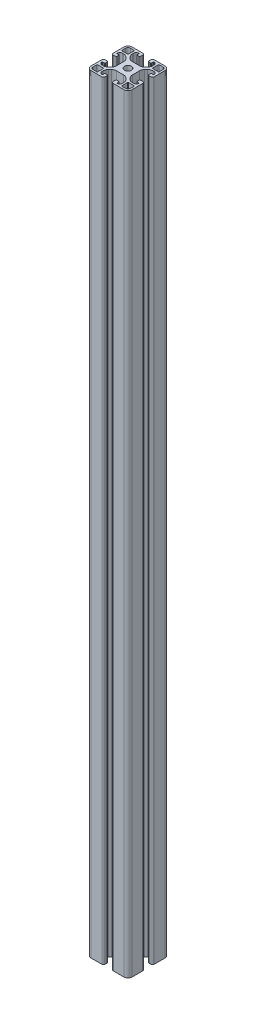
from build123d import *

# Parameters (mm, degrees)
SZKIC2_R                    = 3.4
DODANIE_WYCI_GNI_CIE2_DEPTH = 375


with BuildPart() as part:
    # Szkic2 → Dodanie-wyciągnięcie2 (new, symmetric)
    with BuildSketch(Plane(origin=(0, 0, 0), x_dir=(1, 0, 0), z_dir=(0, 1, 0))):
        with BuildLine():
            Line((-16, 20), (-5.499994708, 20))
            ThreePointArc((-5.499994708, 20), (-4.439334536, 19.560660172), (-3.999994708, 18.5))
            Line((-3.999994708, 18.5), (-3.999994708, 16.5))
            ThreePointArc((-3.999994708, 16.5), (-4.292887927, 15.792893219), (-4.999994708, 15.5))
            Line((-4.999994708, 15.5), (-6.499994708, 15.5))
            ThreePointArc((-6.499994708, 15.5), (-6.853548099, 15.646446609), (-6.999994708, 16))
            Line((-6.999994708, 16), (-6.999994708, 17.5))
            ThreePointArc((-6.999994708, 17.5), (-7.14644085, 17.853552923), (-7.499993385, 18))
            ThreePointArc((-7.499993385, 18), (-9.267764614, 17.267769292), (-10, 15.5))
            Line((-10, 15.5), (-10, 14.171067812))
            ThreePointArc((-10, 14.171067812), (-9.619397663, 12.25765065), (-8.535533906, 10.635533906))
            Line((-8.535533906, 10.635533906), (-7.114466094, 9.214466094))
            ThreePointArc((-7.114466094, 9.214466094), (-5.49234935, 8.130602337), (-3.578932188, 7.75))
            Line((-3.578932188, 7.75), (3.578932188, 7.75))
            ThreePointArc((3.578932188, 7.75), (5.49234935, 8.130602337), (7.114466094, 9.214466094))
            Line((7.114466094, 9.214466094), (8.535533906, 10.635533906))
            ThreePointArc((8.535533906, 10.635533906), (9.619397663, 12.25765065), (10, 14.171067812))
            Line((10, 14.171067812), (10, 15.5))
            ThreePointArc((10, 15.5), (9.267769292, 17.267764614), (7.500006615, 18))
            ThreePointArc((7.500006615, 18), (7.146452369, 17.853553858), (7.000005292, 17.5))
            Line((7.000005292, 17.5), (7.000005292, 16))
            ThreePointArc((7.000005292, 16), (6.853558682, 15.646446609), (6.500005292, 15.5))
            Line((6.500005292, 15.5), (5.000005292, 15.5))
            ThreePointArc((5.000005292, 15.5), (4.292898511, 15.792893219), (4.000005292, 16.5))
            Line((4.000005292, 16.5), (4.000005292, 18.5))
            ThreePointArc((4.000005292, 18.5), (4.43934512, 19.560660172), (5.500005292, 20))
            Line((5.500005292, 20), (16, 20))
            ThreePointArc((16, 20), (18.828427125, 18.828427125), (20, 16))
            Line((20, 16), (20, 5.499994708))
            ThreePointArc((20, 5.499994708), (19.560660172, 4.439334536), (18.5, 3.999994708))
            Line((18.5, 3.999994708), (16.5, 3.999994708))
            ThreePointArc((16.5, 3.999994708), (15.792893219, 4.292887927), (15.5, 4.999994708))
            Line((15.5, 4.999994708), (15.5, 6.499994708))
            ThreePointArc((15.5, 6.499994708), (15.646446609, 6.853548099), (16, 6.999994708))
            Line((16, 6.999994708), (17.5, 6.999994708))
            ThreePointArc((17.5, 6.999994708), (17.853552923, 7.14644085), (18, 7.499993385))
            ThreePointArc((18, 7.499993385), (17.267769292, 9.267764614), (15.5, 10))
            Line((15.5, 10), (14.171067812, 10))
            ThreePointArc((14.171067812, 10), (12.25765065, 9.619397663), (10.635533906, 8.535533906))
            Line((10.635533906, 8.535533906), (9.214466094, 7.114466094))
            ThreePointArc((9.214466094, 7.114466094), (8.130602337, 5.49234935), (7.75, 3.578932188))
            Line((7.75, 3.578932188), (7.75, -3.578932188))
            ThreePointArc((7.75, -3.578932188), (8.130602337, -5.49234935), (9.214466094, -7.114466094))
            Line((9.214466094, -7.114466094), (10.635533906, -8.535533906))
            ThreePointArc((10.635533906, -8.535533906), (12.25765065, -9.619397663), (14.171067812, -10))
            Line((14.171067812, -10), (15.5, -10))
            ThreePointArc((15.5, -10), (17.267764614, -9.267769292), (18, -7.500006615))
            ThreePointArc((18, -7.500006615), (17.853553858, -7.146452369), (17.5, -7.000005292))
            Line((17.5, -7.000005292), (16, -7.000005292))
            ThreePointArc((16, -7.000005292), (15.646446609, -6.853558682), (15.5, -6.500005292))
            Line((15.5, -6.500005292), (15.5, -5.000005292))
            ThreePointArc((15.5, -5.000005292), (15.792893219, -4.292898511), (16.5, -4.000005292))
            Line((16.5, -4.000005292), (18.5, -4.000005292))
            ThreePointArc((18.5, -4.000005292), (19.560660172, -4.43934512), (20, -5.500005292))
            Line((20, -5.500005292), (20, -16))
            ThreePointArc((20, -16), (18.828427125, -18.828427125), (16, -20))
            Line((16, -20), (5.499994708, -20))
            ThreePointArc((5.499994708, -20), (4.439334536, -19.560660172), (3.999994708, -18.5))
            Line((3.999994708, -18.5), (3.999994708, -16.5))
            ThreePointArc((3.999994708, -16.5), (4.292887927, -15.792893219), (4.999994708, -15.5))
            Line((4.999994708, -15.5), (6.499994708, -15.5))
            ThreePointArc((6.499994708, -15.5), (6.853548099, -15.646446609), (6.999994708, -16))
            Line((6.999994708, -16), (6.999994708, -17.5))
            ThreePointArc((6.999994708, -17.5), (7.14644085, -17.853552923), (7.499993385, -18))
            ThreePointArc((7.499993385, -18), (9.267764614, -17.267769292), (10, -15.5))
            Line((10, -15.5), (10, -14.171067812))
            ThreePointArc((10, -14.171067812), (9.619397663, -12.25765065), (8.535533906, -10.635533906))
            Line((8.535533906, -10.635533906), (7.114466094, -9.214466094))
            ThreePointArc((7.114466094, -9.214466094), (5.49234935, -8.130602337), (3.578932188, -7.75))
            Line((3.578932188, -7.75), (-3.578932188, -7.75))
            ThreePointArc((-3.578932188, -7.75), (-5.49234935, -8.130602337), (-7.114466094, -9.214466094))
            Line((-7.114466094, -9.214466094), (-8.535533906, -10.635533906))
            ThreePointArc((-8.535533906, -10.635533906), (-9.619397663, -12.25765065), (-10, -14.171067812))
            Line((-10, -14.171067812), (-10, -15.5))
            ThreePointArc((-10, -15.5), (-9.267769292, -17.267764614), (-7.500006615, -18))
            ThreePointArc((-7.500006615, -18), (-7.146452369, -17.853553858), (-7.000005292, -17.5))
            Line((-7.000005292, -17.5), (-7.000005292, -16))
            ThreePointArc((-7.000005292, -16), (-6.853558682, -15.646446609), (-6.500005292, -15.5))
            Line((-6.500005292, -15.5), (-5.000005292, -15.5))
            ThreePointArc((-5.000005292, -15.5), (-4.292898511, -15.792893219), (-4.000005292, -16.5))
            Line((-4.000005292, -16.5), (-4.000005292, -18.5))
            ThreePointArc((-4.000005292, -18.5), (-4.43934512, -19.560660172), (-5.500005292, -20))
            Line((-5.500005292, -20), (-16, -20))
            ThreePointArc((-16, -20), (-18.828427125, -18.828427125), (-20, -16))
            Line((-20, -16), (-20, -5.499994708))
            ThreePointArc((-20, -5.499994708), (-19.560660172, -4.439334536), (-18.5, -3.999994708))
            Line((-18.5, -3.999994708), (-16.5, -3.999994708))
            ThreePointArc((-16.5, -3.999994708), (-15.792893219, -4.292887927), (-15.5, -4.999994708))
            Line((-15.5, -4.999994708), (-15.5, -6.499994708))
            ThreePointArc((-15.5, -6.499994708), (-15.646446609, -6.853548099), (-16, -6.999994708))
            Line((-16, -6.999994708), (-17.5, -6.999994708))
            ThreePointArc((-17.5, -6.999994708), (-17.853552923, -7.14644085), (-18, -7.499993385))
            ThreePointArc((-18, -7.499993385), (-17.267769292, -9.267764614), (-15.5, -10))
            Line((-15.5, -10), (-14.171067812, -10))
            ThreePointArc((-14.171067812, -10), (-12.25765065, -9.619397663), (-10.635533906, -8.535533906))
            Line((-10.635533906, -8.535533906), (-9.214466094, -7.114466094))
            ThreePointArc((-9.214466094, -7.114466094), (-8.130602337, -5.49234935), (-7.75, -3.578932188))
            Line((-7.75, -3.578932188), (-7.75, 3.578932188))
            ThreePointArc((-7.75, 3.578932188), (-8.130602337, 5.49234935), (-9.214466094, 7.114466094))
            Line((-9.214466094, 7.114466094), (-10.635533906, 8.535533906))
            ThreePointArc((-10.635533906, 8.535533906), (-12.25765065, 9.619397663), (-14.171067812, 10))
            Line((-14.171067812, 10), (-15.5, 10))
            ThreePointArc((-15.5, 10), (-17.267764614, 9.267769292), (-18, 7.500006615))
            ThreePointArc((-18, 7.500006615), (-17.853553858, 7.146452369), (-17.5, 7.000005292))
            Line((-17.5, 7.000005292), (-16, 7.000005292))
            ThreePointArc((-16, 7.000005292), (-15.646446609, 6.853558682), (-15.5, 6.500005292))
            Line((-15.5, 6.500005292), (-15.5, 5.000005292))
            ThreePointArc((-15.5, 5.000005292), (-15.792893219, 4.292898511), (-16.5, 4.000005292))
            Line((-16.5, 4.000005292), (-18.5, 4.000005292))
            ThreePointArc((-18.5, 4.000005292), (-19.560660172, 4.43934512), (-20, 5.500005292))
            Line((-20, 5.500005292), (-20, 16))
            ThreePointArc((-20, 16), (-18.828427125, 18.828427125), (-16, 20))
        make_face()
        Circle(SZKIC2_R, mode=Mode.SUBTRACT)
        with BuildLine():
            Line((-11.8, -17.7), (-11.8, -12.3))
            ThreePointArc((-11.8, -12.3), (-11.946446609, -11.946446609), (-12.3, -11.8))
            Line((-12.3, -11.8), (-17.7, -11.8))
            ThreePointArc((-17.7, -11.8), (-18.053553391, -11.946446609), (-18.2, -12.3))
            Line((-18.2, -12.3), (-18.2, -16))
            ThreePointArc((-18.2, -16), (-17.555634919, -17.555634919), (-16, -18.2))
            Line((-16, -18.2), (-12.3, -18.2))
            ThreePointArc((-12.3, -18.2), (-11.946446609, -18.053553391), (-11.8, -17.7))
        make_face(mode=Mode.SUBTRACT)
        with BuildLine():
            Line((17.7, -11.8), (12.3, -11.8))
            ThreePointArc((12.3, -11.8), (11.946446609, -11.946446609), (11.8, -12.3))
            Line((11.8, -12.3), (11.8, -17.7))
            ThreePointArc((11.8, -17.7), (11.946446609, -18.053553391), (12.3, -18.2))
            Line((12.3, -18.2), (16, -18.2))
            ThreePointArc((16, -18.2), (17.555634919, -17.555634919), (18.2, -16))
            Line((18.2, -16), (18.2, -12.3))
            ThreePointArc((18.2, -12.3), (18.053553391, -11.946446609), (17.7, -11.8))
        make_face(mode=Mode.SUBTRACT)
        with BuildLine():
            Line((11.8, 17.7), (11.8, 12.3))
            ThreePointArc((11.8, 12.3), (11.946446609, 11.946446609), (12.3, 11.8))
            Line((12.3, 11.8), (17.7, 11.8))
            ThreePointArc((17.7, 11.8), (18.053553391, 11.946446609), (18.2, 12.3))
            Line((18.2, 12.3), (18.2, 16))
            ThreePointArc((18.2, 16), (17.555634919, 17.555634919), (16, 18.2))
            Line((16, 18.2), (12.3, 18.2))
            ThreePointArc((12.3, 18.2), (11.946446609, 18.053553391), (11.8, 17.7))
        make_face(mode=Mode.SUBTRACT)
        with BuildLine():
            Line((-11.8, 12.3), (-11.8, 17.7))
            ThreePointArc((-11.8, 17.7), (-11.946446609, 18.053553391), (-12.3, 18.2))
            Line((-12.3, 18.2), (-16, 18.2))
            ThreePointArc((-16, 18.2), (-17.555634919, 17.555634919), (-18.2, 16))
            Line((-18.2, 16), (-18.2, 12.3))
            ThreePointArc((-18.2, 12.3), (-18.053553391, 11.946446609), (-17.7, 11.8))
            Line((-17.7, 11.8), (-12.3, 11.8))
            ThreePointArc((-12.3, 11.8), (-11.946446609, 11.946446609), (-11.8, 12.3))
        make_face(mode=Mode.SUBTRACT)
    extrude(amount=DODANIE_WYCI_GNI_CIE2_DEPTH, both=True)


solid = part.part
